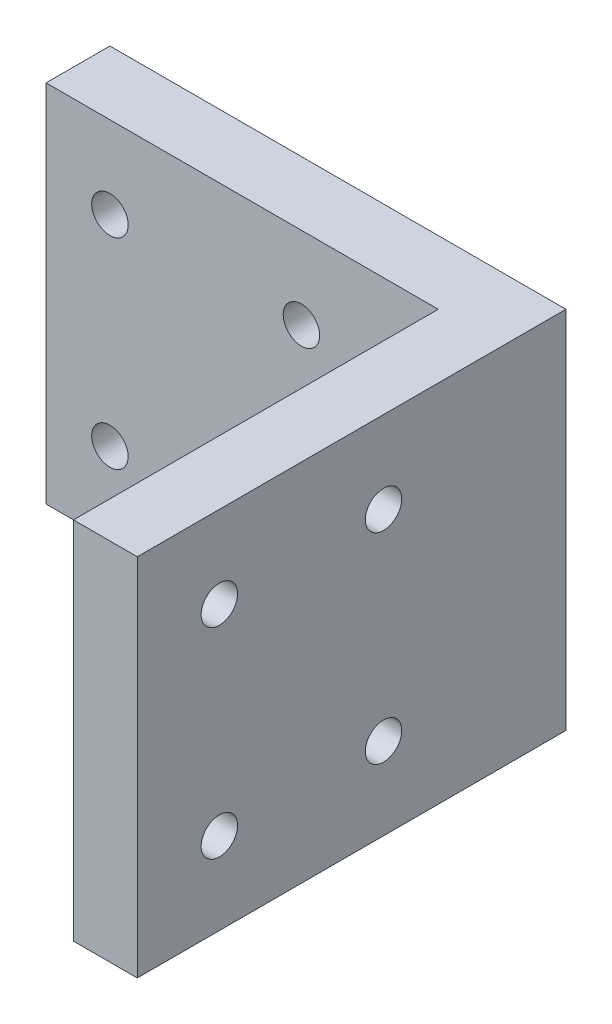
from build123d import *

# Parameters (mm, degrees)
SKETCH1_W           = 50
SKETCH1_H           = 40
BOSS_EXTRUDE1_DEPTH = 7
SKETCH2_W           = 7
SKETCH2_H           = 40
BOSS_EXTRUDE2_DEPTH = 40
SKETCH3_R           = 2
CUT_EXTRUDE1_DEPTH  = 40
SKETCH4_R           = 2
CUT_EXTRUDE2_DEPTH  = 40


with BuildPart() as part:
    # Sketch1 → Boss-Extrude1 (new body)
    with BuildSketch(Plane.XY):
        with Locations((-20.217391304, -11.086956522)):
            Rectangle(SKETCH1_W, SKETCH1_H)
    extrude(amount=BOSS_EXTRUDE1_DEPTH)

    # Sketch2 → Boss-Extrude2 (add)
    with BuildSketch(Plane.XY.offset(7)):
        with Locations((1.282608696, -11.086956522)):
            Rectangle(SKETCH2_W, SKETCH2_H)
    extrude(amount=BOSS_EXTRUDE2_DEPTH)

    # Sketch3 → Cut-Extrude1 (cut)
    with BuildSketch(Plane.XY.offset(7)):
        with Locations((-38.217391304, -0.086956522)):
            Circle(SKETCH3_R)
        with Locations((-38.217391304, -22.086956522)):
            Circle(SKETCH3_R)
        with Locations((-17.217391304, -0.086956522)):
            Circle(SKETCH3_R)
        with Locations((-17.217391304, -22.086956522)):
            Circle(SKETCH3_R)
    extrude(amount=-CUT_EXTRUDE1_DEPTH, mode=Mode.SUBTRACT)

    # Sketch4 → Cut-Extrude2 (cut)
    with BuildSketch(Plane.ZY.offset(2.217391304)):
        with Locations(Location((38, -0.086956522, 0), (0, 0, 270))):
            Circle(SKETCH4_R)
        with Locations(Location((38, -22.086956522, 0), (0, 0, 270))):
            Circle(SKETCH4_R)
        with Locations(Location((20, -0.086956522, 0), (0, 0, 270))):
            Circle(SKETCH4_R)
        with Locations(Location((20, -22.086956522, 0), (0, 0, 270))):
            Circle(SKETCH4_R)
    extrude(amount=-CUT_EXTRUDE2_DEPTH, mode=Mode.SUBTRACT)


solid = part.part
